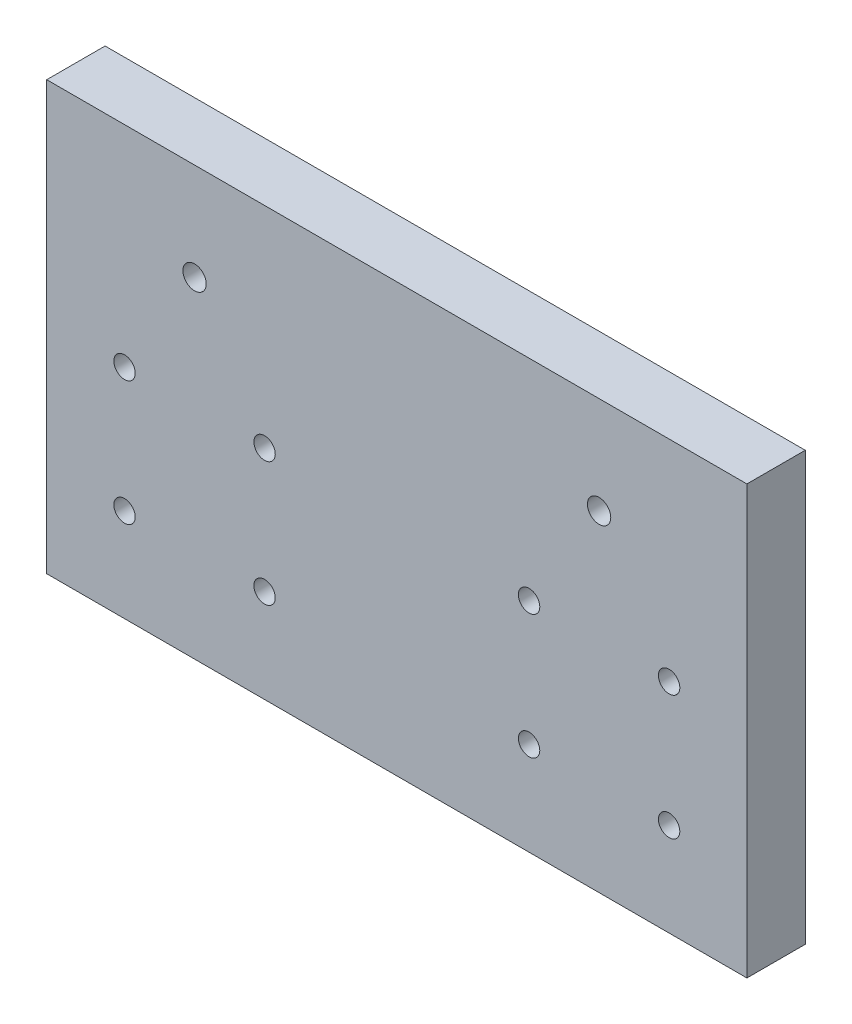
from build123d import *

# Parameters (mm, degrees)
SKIZZE1_W                       = 180
SKIZZE1_H                       = 110
AUFSATZ_LINEAR_AUSTRAGEN1_DEPTH = 15
SKIZZE2_R                       = 2.75
SCHNITT_LINEAR_AUSTRAGEN1_DEPTH = 40
SKIZZE3_R                       = 3
SCHNITT_LINEAR_AUSTRAGEN2_DEPTH = 40


with BuildPart() as part:
    # Skizze1 → Aufsatz-Linear austragen1 (new body)
    with BuildSketch(Plane.XY):
        with Locations((0, 55)):
            Rectangle(SKIZZE1_W, SKIZZE1_H)
    extrude(amount=AUFSATZ_LINEAR_AUSTRAGEN1_DEPTH)

    # Skizze2 → Schnitt-Linear austragen1 (cut)
    with BuildSketch(Plane.XY.offset(15)):
        with Locations((34, 24)):
            Circle(SKIZZE2_R)
        with Locations((70, 24)):
            Circle(SKIZZE2_R)
        with Locations(Location((70, 56, 0), (0, 0, 180))):
            Circle(SKIZZE2_R)
        with Locations(Location((34, 56, 0), (0, 0, 180))):
            Circle(SKIZZE2_R)
        with Locations(Location((-34, 24, 0), (0, 0, 180))):
            Circle(SKIZZE2_R)
        with Locations(Location((-70, 24, 0), (0, 0, 180))):
            Circle(SKIZZE2_R)
        with Locations((-70, 56)):
            Circle(SKIZZE2_R)
        with Locations((-34, 56)):
            Circle(SKIZZE2_R)
    extrude(amount=-SCHNITT_LINEAR_AUSTRAGEN1_DEPTH, mode=Mode.SUBTRACT)

    # Skizze3 → Schnitt-Linear austragen2 (cut)
    with BuildSketch(Plane.XY.offset(15)):
        with Locations((52, 85)):
            Circle(SKIZZE3_R)
        with Locations(Location((-52, 85, 0), (0, 0, 180))):
            Circle(SKIZZE3_R)
    extrude(amount=-SCHNITT_LINEAR_AUSTRAGEN2_DEPTH, mode=Mode.SUBTRACT)


solid = part.part
